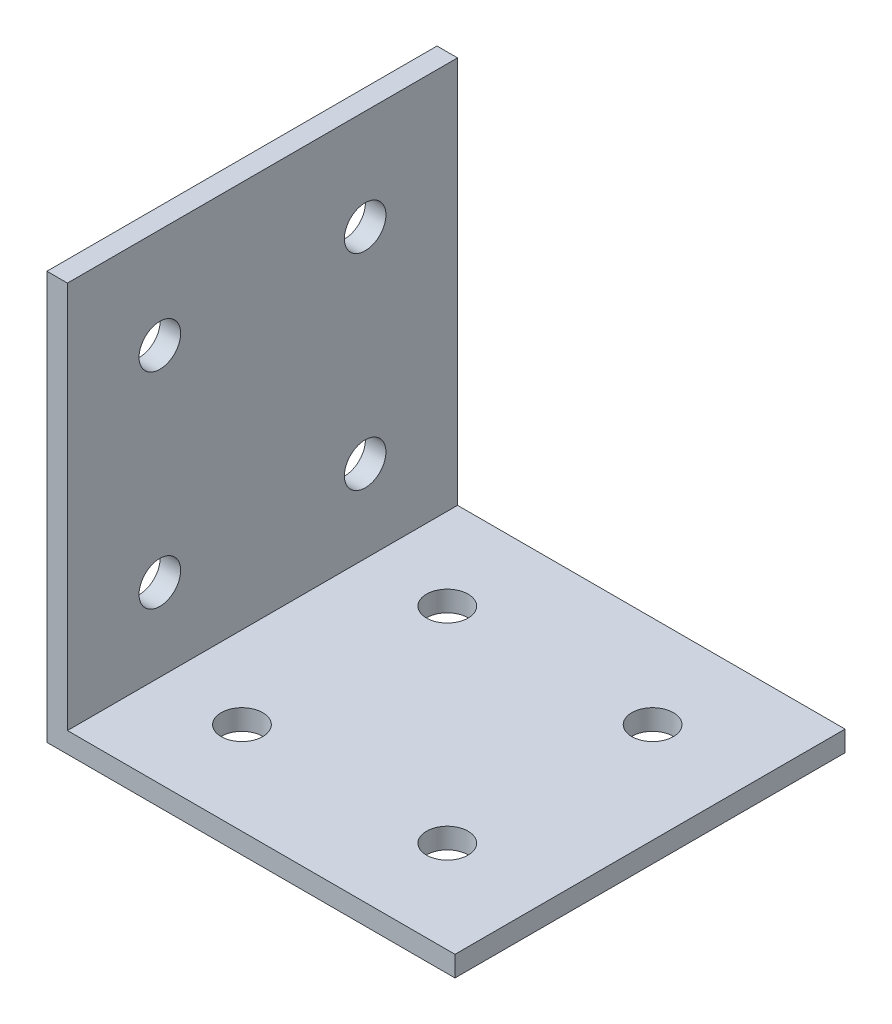
from build123d import *

# Parameters (mm, degrees)
SKETCH1_W               = 79.5
SKETCH1_H               = 76
SKETCH1_R               = 4.05
BOSS_EXTRUDE1_DEPTH     = 79.5
SKETCH2_R               = 4.05
CUT_EXTRUDE1_DEPTH      = 79.5
CUT_EXTRUDE2_DEPTH      = 79.5
CUT_EXTRUDE2_DEPTH_BACK = 79.5
CUT_EXTRUDE3_DEPTH      = 79.5
CUT_EXTRUDE3_DEPTH_BACK = 79.5
SKETCH4_W               = 80.771817398
SKETCH4_H               = 76.525441438


with BuildPart() as part:
    # Sketch1 → Boss-Extrude1 (new body)
    with BuildSketch(Plane(origin=(0, 0, 0), x_dir=(1, 0, 0), z_dir=(0, 1, 0))):
        with Locations((39.75, 0)):
            Rectangle(SKETCH1_W, SKETCH1_H)
        with Locations(Location((20, 20, 0), (0, 0, 90))):
            Circle(SKETCH1_R, mode=Mode.SUBTRACT)
        with Locations(Location((60, 20, 0), (0, 0, 90))):
            Circle(SKETCH1_R, mode=Mode.SUBTRACT)
        with Locations(Location((60, -20, 0), (0, 0, 90))):
            Circle(SKETCH1_R, mode=Mode.SUBTRACT)
        with Locations(Location((20, -20, 0), (0, 0, 90))):
            Circle(SKETCH1_R, mode=Mode.SUBTRACT)
    extrude(amount=BOSS_EXTRUDE1_DEPTH)

    # Sketch2 → Cut-Extrude1 (cut)
    with BuildSketch(Plane(origin=(0, 0, 0), x_dir=(0, 0, -1), z_dir=(1, 0, 0))):
        with Locations((-20, 60)):
            Circle(SKETCH2_R)
        with Locations(Location((20, 60, 0), (0, 0, 180))):
            Circle(SKETCH2_R)
        with Locations(Location((20, 20, 0), (0, 0, 180))):
            Circle(SKETCH2_R)
        with Locations((-20, 20)):
            Circle(SKETCH2_R)
    extrude(amount=CUT_EXTRUDE1_DEPTH, mode=Mode.SUBTRACT)

    # Sketch3 → Cut-Extrude2 (cut, two sides: drawn at the far end of the back side and taken through both)
    with BuildSketch(Plane.XY.offset(-CUT_EXTRUDE2_DEPTH_BACK)):
        Polygon((4, 73.843145751), (4, 4), (73.843145751, 4), align=None)
        Polygon((4, 79.5), (79.5, 4), (79.5, 79.5), align=None)
    extrude(amount=CUT_EXTRUDE2_DEPTH + CUT_EXTRUDE2_DEPTH_BACK, mode=Mode.SUBTRACT)

    # Sketch4 → Cut-Extrude3 (cut, two sides: drawn at the far end of the back side and taken through both)
    with BuildSketch(Plane.XY.offset(-CUT_EXTRUDE3_DEPTH_BACK)):
        with Locations((44.385908699, 42.262720719)):
            Rectangle(SKETCH4_W, SKETCH4_H)
    extrude(amount=CUT_EXTRUDE3_DEPTH + CUT_EXTRUDE3_DEPTH_BACK, mode=Mode.SUBTRACT)


solid = part.part
